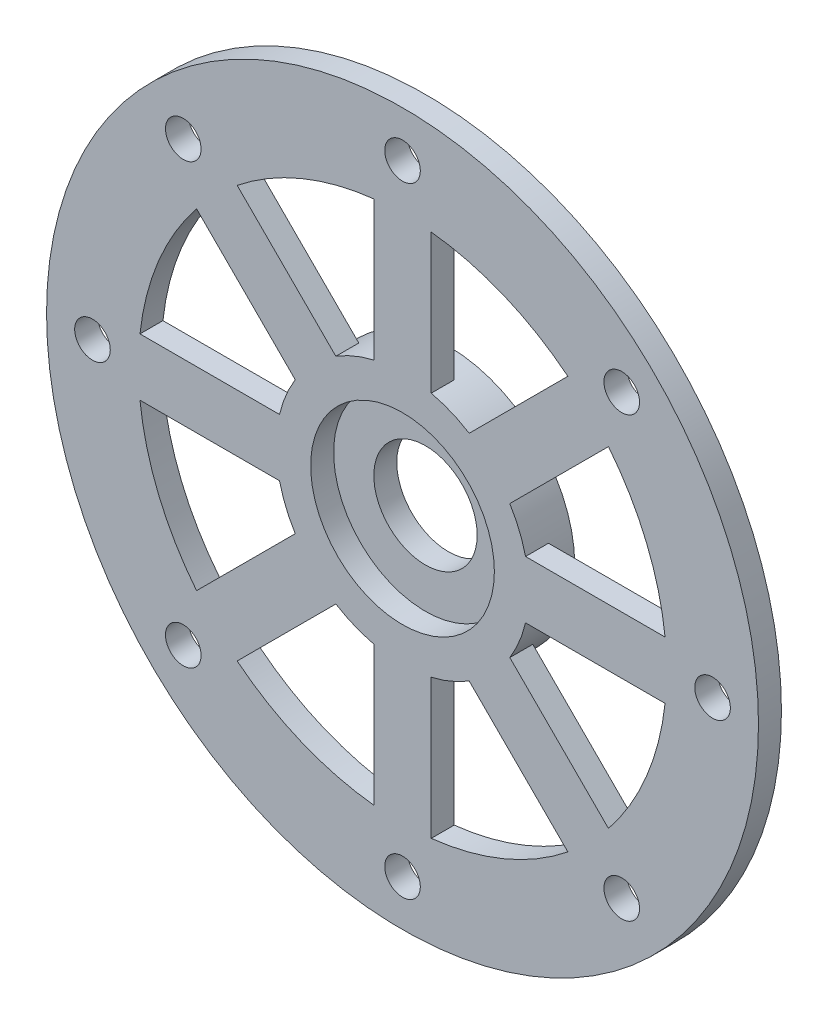
from build123d import *
from build123d.topology import SkipClean

# Parameters (mm, degrees)
SKETCH1_R           = 31
SKETCH1_R_2         = 1.55
BOSS_EXTRUDE1_DEPTH = 2
BOSS_EXTRUDE2_START = 2
SKETCH3_R           = 11
BOSS_EXTRUDE2_DEPTH = 2
SKETCH4_R           = 4.5
CUT_EXTRUDE2_DEPTH  = 4
SKETCH2_R           = 8
CUT_EXTRUDE1_DEPTH  = 2


with BuildPart() as part:
    # Sketch1 → Boss-Extrude1 (new body)
    with BuildSketch(Plane.XY):
        Circle(SKETCH1_R)
        with Locations((-27, 0)):
            Circle(SKETCH1_R_2, mode=Mode.SUBTRACT)
        with Locations((-19.091883092, 19.091883092)):
            Circle(SKETCH1_R_2, mode=Mode.SUBTRACT)
        with Locations((0, 27)):
            Circle(SKETCH1_R_2, mode=Mode.SUBTRACT)
        with Locations((19.091883092, 19.091883092)):
            Circle(SKETCH1_R_2, mode=Mode.SUBTRACT)
        with Locations((27, 0)):
            Circle(SKETCH1_R_2, mode=Mode.SUBTRACT)
        with Locations((19.091883092, -19.091883092)):
            Circle(SKETCH1_R_2, mode=Mode.SUBTRACT)
        with Locations((0, -27)):
            Circle(SKETCH1_R_2, mode=Mode.SUBTRACT)
        with Locations((-19.091883092, -19.091883092)):
            Circle(SKETCH1_R_2, mode=Mode.SUBTRACT)
        with BuildLine():
            Line((-10.712142643, 2.5), (-22.86372673, 2.5))
            ThreePointArc((-22.86372673, 2.5), (-21.249229248, 8.801718944), (-17.934863167, 14.399329261))
            Line((-17.934863167, 14.399329261), (-9.342395657, 5.806861751))
            ThreePointArc((-9.342395657, 5.806861751), (-10.162674858, 4.209517756), (-10.712142643, 2.5))
        make_face(mode=Mode.SUBTRACT)
        with BuildLine():
            Line((-10.712142643, -2.5), (-22.86372673, -2.5))
            ThreePointArc((-22.86372673, -2.5), (-21.249229248, -8.801718944), (-17.934863167, -14.399329261))
            Line((-17.934863167, -14.399329261), (-9.342395657, -5.806861751))
            ThreePointArc((-9.342395657, -5.806861751), (-10.162674858, -4.209517756), (-10.712142643, -2.5))
        make_face(mode=Mode.SUBTRACT)
        with BuildLine():
            Line((-5.806861751, 9.342395657), (-14.399329261, 17.934863167))
            ThreePointArc((-14.399329261, 17.934863167), (-8.801718944, 21.249229248), (-2.5, 22.86372673))
            Line((-2.5, 22.86372673), (-2.5, 10.712142643))
            ThreePointArc((-2.5, 10.712142643), (-4.209517756, 10.162674858), (-5.806861751, 9.342395657))
        make_face(mode=Mode.SUBTRACT)
        with BuildLine():
            Line((2.5, 10.712142643), (2.5, 22.86372673))
            ThreePointArc((2.5, 22.86372673), (8.801718944, 21.249229248), (14.399329261, 17.934863167))
            Line((14.399329261, 17.934863167), (5.806861751, 9.342395657))
            ThreePointArc((5.806861751, 9.342395657), (4.209517756, 10.162674858), (2.5, 10.712142643))
        make_face(mode=Mode.SUBTRACT)
        with BuildLine():
            Line((9.342395657, 5.806861751), (17.934863167, 14.399329261))
            ThreePointArc((17.934863167, 14.399329261), (21.249229248, 8.801718944), (22.86372673, 2.5))
            Line((22.86372673, 2.5), (10.712142643, 2.5))
            ThreePointArc((10.712142643, 2.5), (10.162674858, 4.209517756), (9.342395657, 5.806861751))
        make_face(mode=Mode.SUBTRACT)
        with BuildLine():
            Line((10.712142643, -2.5), (22.86372673, -2.5))
            ThreePointArc((22.86372673, -2.5), (21.249229248, -8.801718944), (17.934863167, -14.399329261))
            Line((17.934863167, -14.399329261), (9.342395657, -5.806861751))
            ThreePointArc((9.342395657, -5.806861751), (10.162674858, -4.209517756), (10.712142643, -2.5))
        make_face(mode=Mode.SUBTRACT)
        with BuildLine():
            Line((5.806861751, -9.342395657), (14.399329261, -17.934863167))
            ThreePointArc((14.399329261, -17.934863167), (8.801718944, -21.249229248), (2.5, -22.86372673))
            Line((2.5, -22.86372673), (2.5, -10.712142643))
            ThreePointArc((2.5, -10.712142643), (4.209517756, -10.162674858), (5.806861751, -9.342395657))
        make_face(mode=Mode.SUBTRACT)
        with BuildLine():
            Line((-2.5, -10.712142643), (-2.5, -22.86372673))
            ThreePointArc((-2.5, -22.86372673), (-8.801718944, -21.249229248), (-14.399329261, -17.934863167))
            Line((-14.399329261, -17.934863167), (-5.806861751, -9.342395657))
            ThreePointArc((-5.806861751, -9.342395657), (-4.209517756, -10.162674858), (-2.5, -10.712142643))
        make_face(mode=Mode.SUBTRACT)
    extrude(amount=BOSS_EXTRUDE1_DEPTH)

    # Sketch3 → Boss-Extrude2 (add)
    with SkipClean():  # the faces are left unmerged after this step: merging them gives an invalid solid
        with BuildSketch(Plane(origin=(0, 0, 0), x_dir=(-1, 0, 0), z_dir=(0, 0, -1)).offset(BOSS_EXTRUDE2_START)):
            Circle(SKETCH3_R)
        extrude(amount=-BOSS_EXTRUDE2_DEPTH)

    # Sketch4 → Cut-Extrude2 (cut)
    with SkipClean():  # the faces are left unmerged after this step: merging them gives an invalid solid
        with BuildSketch(Plane.XY.offset(2)):
            Circle(SKETCH4_R)
        extrude(amount=-CUT_EXTRUDE2_DEPTH, mode=Mode.SUBTRACT)

    # Sketch2 → Cut-Extrude1 (cut)
    with SkipClean():  # the faces are left unmerged after this step: merging them gives an invalid solid
        with BuildSketch(Plane.XY.offset(2)):
            Circle(SKETCH2_R)
        extrude(amount=-CUT_EXTRUDE1_DEPTH, mode=Mode.SUBTRACT)


solid = part.part
